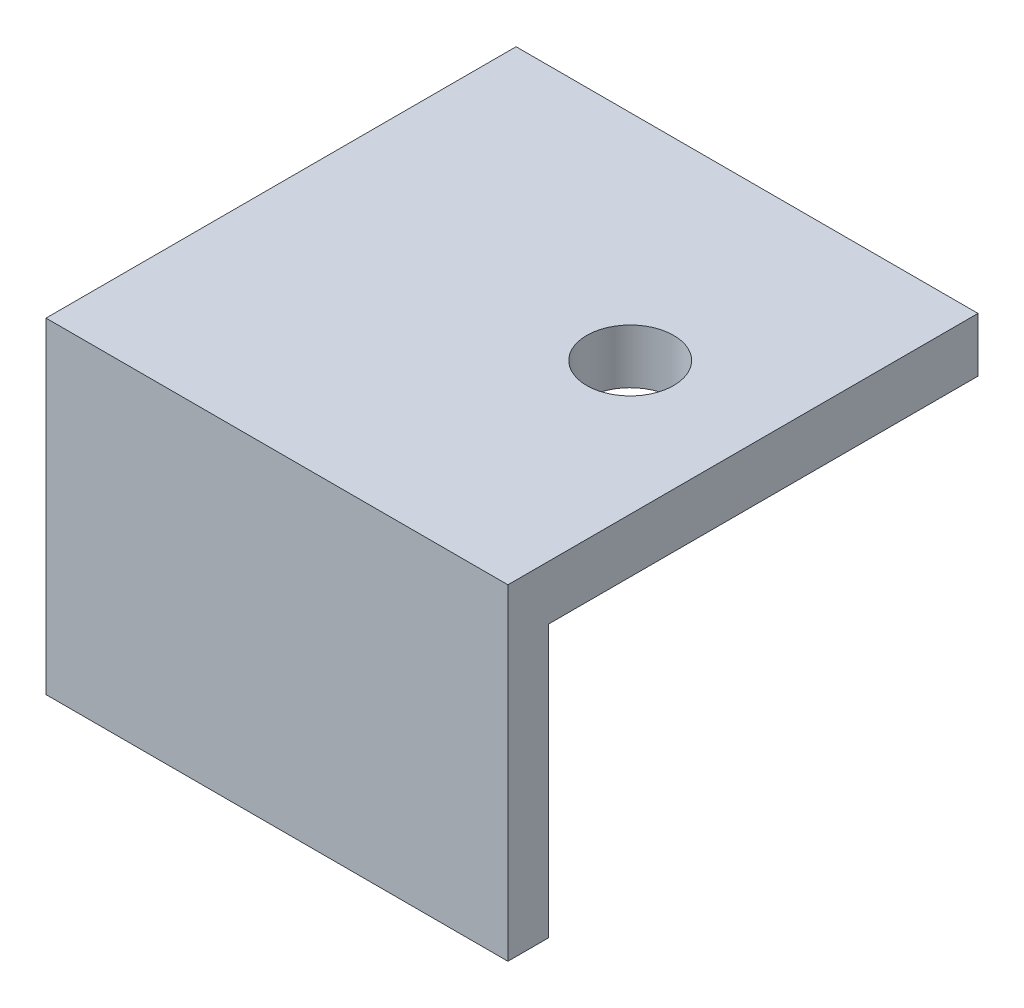
from build123d import *

# Parameters (mm, degrees)
EXTRUDE_1_DEPTH     = 10
SKETCH_2_W          = 17
SKETCH_2_H          = 18.8
SKETCH_2_R          = 1.6
EXTRUDE_2_DEPTH     = 2
SKETCH_4_W          = 17
SKETCH_4_H          = 1.5
CUT_EXTRUDE_1_DEPTH = 29.04353758


with BuildPart() as part:
    # 草图1 → 凸台-拉伸1 (new body)
    with BuildSketch(Plane(origin=(0, 0, 0), x_dir=(1, 0, 0), z_dir=(0, 1, 0))):
        Polygon((1.5, 1.5), (1.5, 17.3), (15.5, 17.3), (17, 17.3), (17, 18.8), (0, 18.8), (0, 0), (17, 0), (17, 1.5), (15.5, 1.5), align=None)
    extrude(amount=EXTRUDE_1_DEPTH)

    # 草图2 → 凸台-拉伸2 (add)
    with BuildSketch(Plane(origin=(0, 10, 0), x_dir=(1, 0, 0), z_dir=(0, 1, 0))):
        with Locations((8.5, 9.4)):
            Rectangle(SKETCH_2_W, SKETCH_2_H)
        with Locations(Location((12.1, 9.4, 0), (0, 0, 270))):
            Circle(SKETCH_2_R, mode=Mode.SUBTRACT)
    extrude(amount=EXTRUDE_2_DEPTH)

    # 草图4 → 切除-拉伸1 (cut, through all)
    with BuildSketch(Plane.XZ):
        with Locations((8.5, -18.05)):
            Rectangle(SKETCH_4_W, SKETCH_4_H)
    extrude(amount=-CUT_EXTRUDE_1_DEPTH, mode=Mode.SUBTRACT)


solid = part.part
